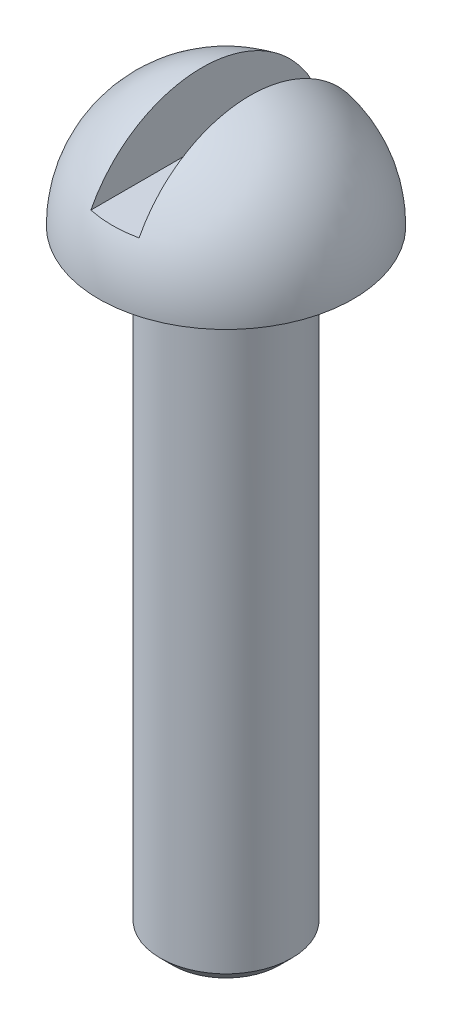
from build123d import *

# Parameters (mm, degrees)
CHAMFER_1_SIZE           = 0.2805
CUT_EXTRUDE_2_DEPTH      = 15.588351518
CUT_EXTRUDE_2_DEPTH_BACK = 15.588351518
SKETCH_4_W               = 1.1
SKETCH_4_H               = 3.2


with BuildPart() as part:
    # Эскиз1 → Повернуть1 (revolve)
    with BuildSketch(Plane.XY):
        with BuildLine():
            ThreePointArc((0, 2.9), (2.050609665, 2.050609665), (2.9, 0))
            Line((2.9, 0), (1.5, 0))
            Line((1.5, 0), (1.5, -14))
            Line((1.5, -14), (0, -14))
            Line((0, -14), (0, 2.9))
        make_face()
    revolve(axis=Axis((0, 2.9, 0), (0, -1, 0)))

    # Фаска1
    chamfer_1_edges = [part.edges().sort_by_distance(p)[0] for p in [
        (-1.5, -14, 0),
    ]]
    chamfer(chamfer_1_edges, length=CHAMFER_1_SIZE)

    # Эскиз4 → Вырез-Вытянуть2 (cut, two sides: drawn at the far end of the back side and taken through both)
    with BuildSketch(Plane.XY.offset(-CUT_EXTRUDE_2_DEPTH_BACK)):
        with Locations((0, 2.9)):
            Rectangle(SKETCH_4_W, SKETCH_4_H)
    extrude(amount=CUT_EXTRUDE_2_DEPTH + CUT_EXTRUDE_2_DEPTH_BACK, mode=Mode.SUBTRACT)


solid = part.part
